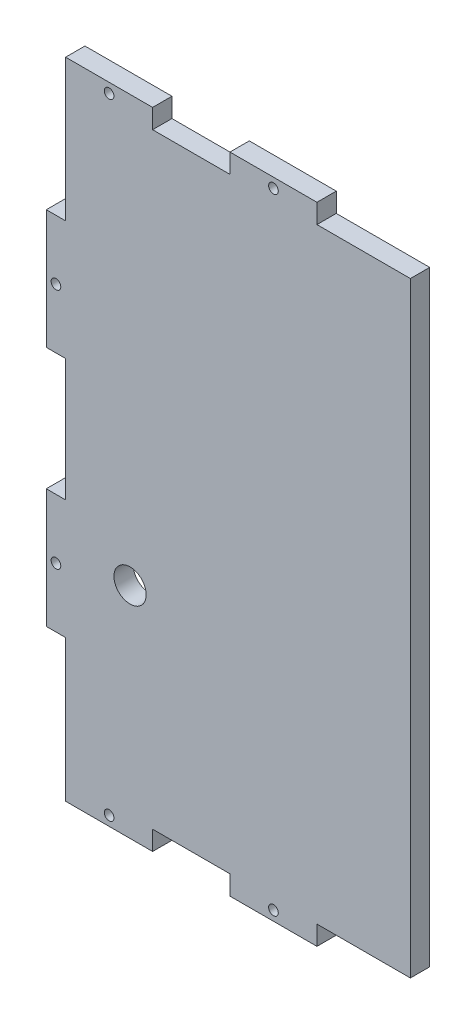
from build123d import *

# Parameters (mm, degrees)
ESQUISSE1_W             = 143
ESQUISSE1_H             = 200
BOSS_EXTRU_1_DEPTH      = 6
ESQUISSE2_W             = 6
ESQUISSE2_H             = 30
ESQUISSE2_W_2           = 29
ESQUISSE2_H_2           = 6
ESQUISSE2_W_3           = 24
ENL_V_MAT_EXTRU_1_DEPTH = 6
ESQUISSE3_W             = 6
ESQUISSE3_H             = 37
BOSS_EXTRU_2_DEPTH      = 6
ESQUISSE4_W             = 36
ESQUISSE4_H             = 200
ENL_V_MAT_EXTRU_2_DEPTH = 10
ESQUISSE5_R             = 2.995
ENL_V_MAT_EXTRU_3_DEPTH = 3
ESQUISSE6_R             = 1.5
ENL_V_MAT_EXTRU_4_DEPTH = 6
ESQUISSE7_R             = 5
ENL_V_MAT_EXTRU_5_DEPTH = 10


with BuildPart() as part:
    # Esquisse1 → Boss.-Extru.1 (new body)
    with BuildSketch(Plane.XY):
        with Locations((-71.5, 100)):
            Rectangle(ESQUISSE1_W, ESQUISSE1_H)
    extrude(amount=BOSS_EXTRU_1_DEPTH)

    # Esquisse2 → Enlèv. mat.-Extru.1 (cut)
    with BuildSketch(Plane(origin=(0, 0, 0), x_dir=(-1, 0, 0), z_dir=(0, 0, -1))):
        with Locations((3, 65)):
            Rectangle(ESQUISSE2_W, ESQUISSE2_H)
        with Locations((3, 135)):
            Rectangle(ESQUISSE2_W, ESQUISSE2_H)
        with Locations((50.5, 3)):
            Rectangle(ESQUISSE2_W_2, ESQUISSE2_H_2)
        with Locations((104, 3)):
            Rectangle(ESQUISSE2_W_3, ESQUISSE2_H_2)
        with Locations((50.5, 197)):
            Rectangle(ESQUISSE2_W_2, ESQUISSE2_H_2)
        with Locations((104, 197)):
            Rectangle(ESQUISSE2_W_3, ESQUISSE2_H_2)
    extrude(amount=-ENL_V_MAT_EXTRU_1_DEPTH, mode=Mode.SUBTRACT)

    # Esquisse3 → Boss.-Extru.2 (add)
    with BuildSketch(Plane.ZY.offset(143)):
        with Locations((3, 62.5)):
            Rectangle(ESQUISSE3_W, ESQUISSE3_H)
        with Locations((3, 137.5)):
            Rectangle(ESQUISSE3_W, ESQUISSE3_H)
    extrude(amount=BOSS_EXTRU_2_DEPTH)

    # Esquisse4 → Enlèv. mat.-Extru.2 (cut)
    with BuildSketch(Plane(origin=(0, 0, 0), x_dir=(-1, 0, 0), z_dir=(0, 0, -1))):
        with Locations((18, 100)):
            Rectangle(ESQUISSE4_W, ESQUISSE4_H)
    extrude(amount=-ENL_V_MAT_EXTRU_2_DEPTH, mode=Mode.SUBTRACT)

    # Esquisse5 → Enlèv. mat.-Extru.3 (cut)
    with BuildSketch(Plane(origin=(0, 0, 0), x_dir=(-1, 0, 0), z_dir=(0, 0, -1))):
        with Locations((78.5, 3)):
            Circle(ESQUISSE5_R)
        with Locations((129.5, 3)):
            Circle(ESQUISSE5_R)
        with Locations((78.5, 197)):
            Circle(ESQUISSE5_R)
        with Locations((129.5, 197)):
            Circle(ESQUISSE5_R)
        with Locations((146, 62.5)):
            Circle(ESQUISSE5_R)
        with Locations((146, 137.5)):
            Circle(ESQUISSE5_R)
    extrude(amount=-ENL_V_MAT_EXTRU_3_DEPTH, mode=Mode.SUBTRACT)

    # Esquisse6 → Enlèv. mat.-Extru.4 (cut)
    with BuildSketch(Plane(origin=(0, 0, 0), x_dir=(-1, 0, 0), z_dir=(0, 0, -1))):
        with Locations((78.5, 3)):
            Circle(ESQUISSE6_R)
        with Locations((129.5, 3)):
            Circle(ESQUISSE6_R)
        with Locations((78.5, 197)):
            Circle(ESQUISSE6_R)
        with Locations((129.5, 197)):
            Circle(ESQUISSE6_R)
        with Locations((146, 62.5)):
            Circle(ESQUISSE6_R)
        with Locations((146, 137.5)):
            Circle(ESQUISSE6_R)
    extrude(amount=-ENL_V_MAT_EXTRU_4_DEPTH, mode=Mode.SUBTRACT)

    # Esquisse7 → Enlèv. mat.-Extru.5 (cut)
    with BuildSketch(Plane(origin=(0, 0, 0), x_dir=(-1, 0, 0), z_dir=(0, 0, -1))):
        with Locations((123, 68)):
            Circle(ESQUISSE7_R)
    extrude(amount=-ENL_V_MAT_EXTRU_5_DEPTH, mode=Mode.SUBTRACT)


solid = part.part
